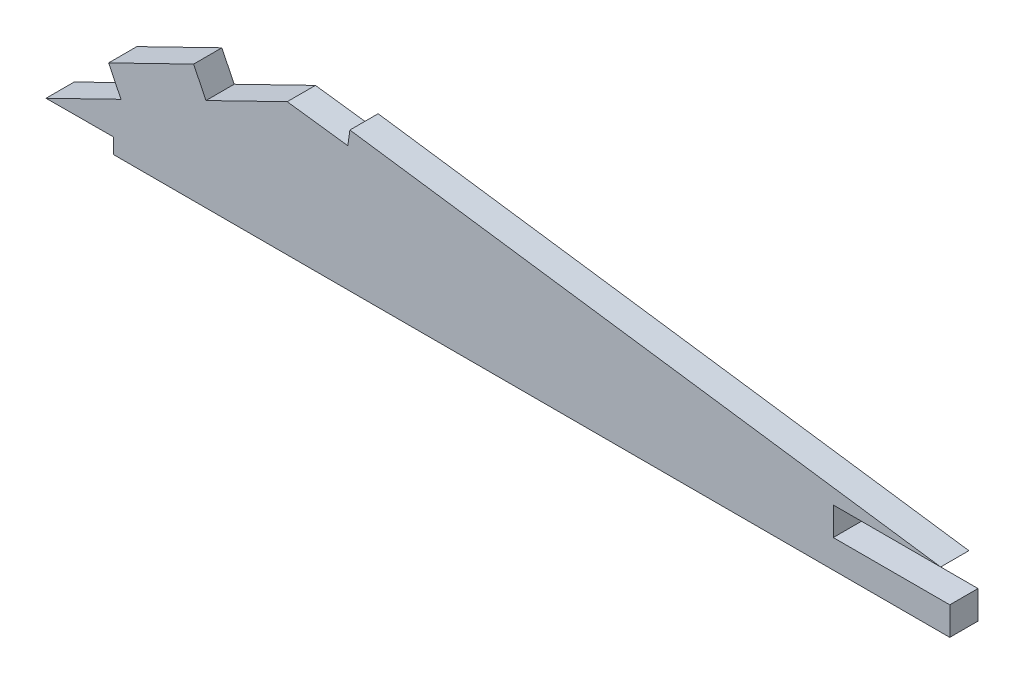
from build123d import *

# Parameters (mm, degrees)
EXTRUDE_1_DEPTH = 2


with BuildPart() as part:
    # Model → 凸台-拉伸1 (new body)
    with BuildSketch(Plane.XY):
        Polygon((2.088676648, 3.910101346), (7.403245844, 6.502189937), (6.52650355, 8.29977803), (12.548873058, 11.237083899), (13.425615351, 9.439495806), (19.181878442, 12.247012904), (23.476104066, 11.69156147), (23.624314119, 12.729253727), (65.489443321, 6.845493524), (57.879272638, 6.845493524), (57.879272638, 4.845493524), (66.135449034, 4.845493524), (66.135449034, 2.845493524), (6.874346071, 2.845493524), (6.870142446, 3.928657617), align=None)
    extrude(amount=EXTRUDE_1_DEPTH)


solid = part.part
